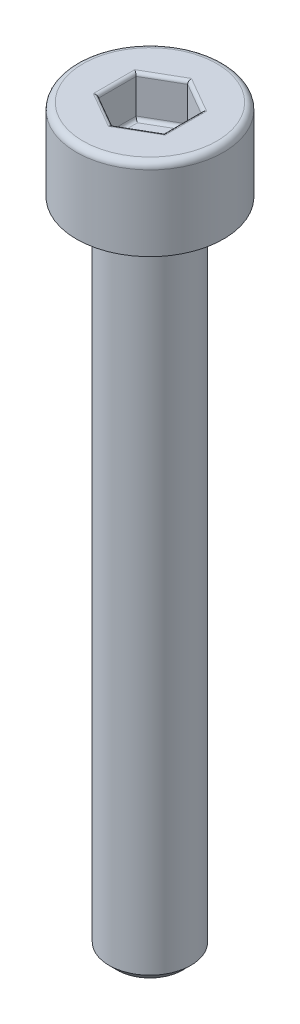
from build123d import *

# Parameters (mm, degrees)
CHAMFER1_SIZE      = 0.25
FILLET1_R          = 0.2
CUT_EXTRUDE1_DEPTH = 1.25
FILLET2_R          = 0.1


with BuildPart() as part:
    # Sketch1 → Revolve1 (revolve)
    with BuildSketch(Plane.XY, mode=Mode.PRIVATE) as revolve1_sk:
        Polygon((0, -22.5), (-1.25, -22.5), (-1.25, -2.5), (-2.25, -2.5), (-2.25, 0), (0, 0), align=None)
    revolve(revolve1_sk.sketch.rotate(Axis((0, 0, 0), (0, -1, 0)), 270), axis=Axis((0, 0, 0), (0, -1, 0)))

    # Chamfer1
    chamfer1_edges = [part.edges().sort_by_distance(p)[0] for p in [
        (0, -2.5, -1.25),
        (0, -22.5, -1.25),
    ]]
    chamfer(chamfer1_edges, length=CHAMFER1_SIZE)

    # Fillet1
    fillet1_edges = [part.edges().sort_by_distance(p)[0] for p in [
        (0, 0, -2.25),
    ]]
    fillet(fillet1_edges, radius=FILLET1_R)

    # Sketch2 → Cut-Extrude1 (cut)
    with BuildSketch(Plane(origin=(0, 0, 0), x_dir=(1, 0, 0), z_dir=(0, 1, 0))):
        Polygon((0, 1.154700538), (-1, 0.577350269), (-1, -0.577350269), (0, -1.154700538), (1, -0.577350269), (1, 0.577350269), align=None)
    extrude(amount=-CUT_EXTRUDE1_DEPTH, mode=Mode.SUBTRACT)

    # Fillet2
    fillet2_edges = [part.edges().sort_by_distance(p)[0] for p in [
        (0.5, -1.25, -0.866025404),
        (1, -1.25, 0),
        (0.5, -1.25, 0.866025404),
        (-0.5, -1.25, 0.866025404),
        (-1, -1.25, 0),
        (-0.5, -1.25, -0.866025404),
        (0.4999999999999987, 0, -0.8660254037844397),
        (-0.5000000000000006, 0, -0.8660254037844395),
        (-1, 0, 0),
        (-0.5000000000000007, 0, 0.8660254037844379),
        (0.4999999999999988, 0, 0.8660254037844382),
        (1, 0, 0),
    ]]
    fillet(fillet2_edges, radius=FILLET2_R)


solid = part.part
